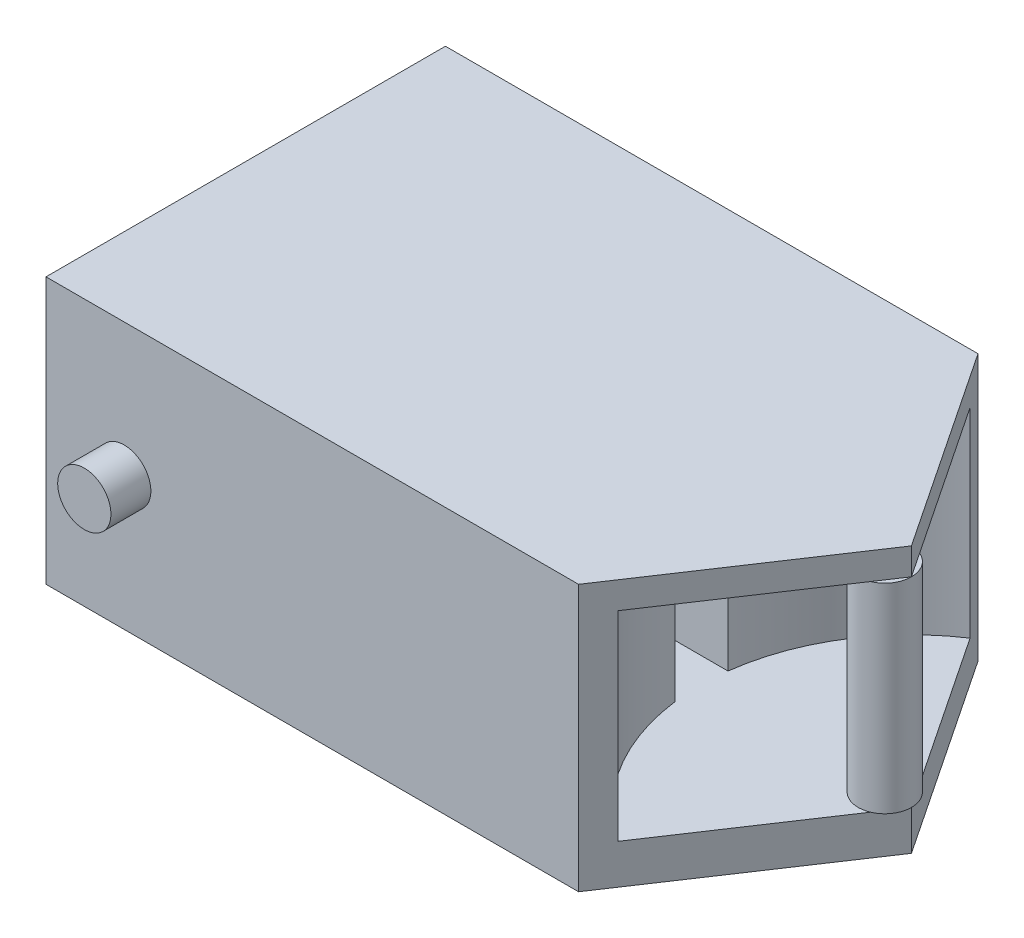
from build123d import *

# Parameters (mm, degrees)
BOSS_EXTRUDE1_DEPTH      = 100
BOSS_EXTRUDE1_DEPTH_BACK = 100
SKETCH2_W                = 135
SKETCH2_H                = 150
CUT_REVOLVE1_ANGLE       = 112.6198649
SKETCH3_R                = 20
BOSS_EXTRUDE3_DEPTH      = 30
SKETCH4_W                = 39.677312781
SKETCH4_H                = 150
CUT_EXTRUDE2_DEPTH       = 500
SKETCH7_W                = 20
SKETCH7_H                = 150


with BuildPart() as part:
    # Sketch1 → Boss-Extrude1 (new, two sides: drawn at the far end of the back side and taken through both)
    with BuildSketch(Plane(origin=(0, 0, 0), x_dir=(1, 0, 0), z_dir=(0, 1, 0)).offset(-BOSS_EXTRUDE1_DEPTH_BACK)):
        Polygon((200, 150), (300, 0), (200, -150), (-200, -150), (-200, 150), align=None)
    extrude(amount=BOSS_EXTRUDE1_DEPTH + BOSS_EXTRUDE1_DEPTH_BACK)

    # Sketch2 → Cut-Revolve1 (revolve, cut)
    with BuildSketch(Plane(origin=(207.692307692, 0, -138.461538462), x_dir=(-0.5547001962252291, 0, -0.8320502943378437), z_dir=(0.8320502943378437, 0, -0.5547001962252291))):
        with Locations((-75.066961244, 4.860296888)):
            Rectangle(SKETCH2_W, SKETCH2_H)
    revolve(axis=Axis((300, -100, 0), (0, 1, 0)), revolution_arc=CUT_REVOLVE1_ANGLE, mode=Mode.SUBTRACT)

    # Sketch3 → Boss-Extrude3 (add)
    with BuildSketch(Plane(origin=(0, 0, -150), x_dir=(-1, 0, 0), z_dir=(0, 0, -1))):
        with Locations((141.22951379, 0)):
            Circle(SKETCH3_R)
    boss_extrude3 = extrude(amount=BOSS_EXTRUDE3_DEPTH)

    # Mirror1: Boss-Extrude3 across plane
    add(boss_extrude3.mirror(Plane(origin=(0, 0, 0), x_dir=(1, 0, 0), z_dir=(0, 0, -1))))

    # Sketch4 → Cut-Extrude2 (cut)
    with BuildSketch(Plane.ZY.offset(200)):
        with Locations((-6e-09, 4.860296888)):
            Rectangle(SKETCH4_W, SKETCH4_H)
    extrude(amount=-CUT_EXTRUDE2_DEPTH, mode=Mode.SUBTRACT)

    # Sketch7 → Revolve2 (revolve)
    with BuildSketch(Plane(origin=(0, 0, 0), x_dir=(-1, 0, 0), z_dir=(0, 0, -1))):
        with Locations((-290, 4.860296888)):
            Rectangle(SKETCH7_W, SKETCH7_H)
    revolve(axis=Axis((280, 79.860296888, 0), (0, -1, 0)))


solid = part.part
